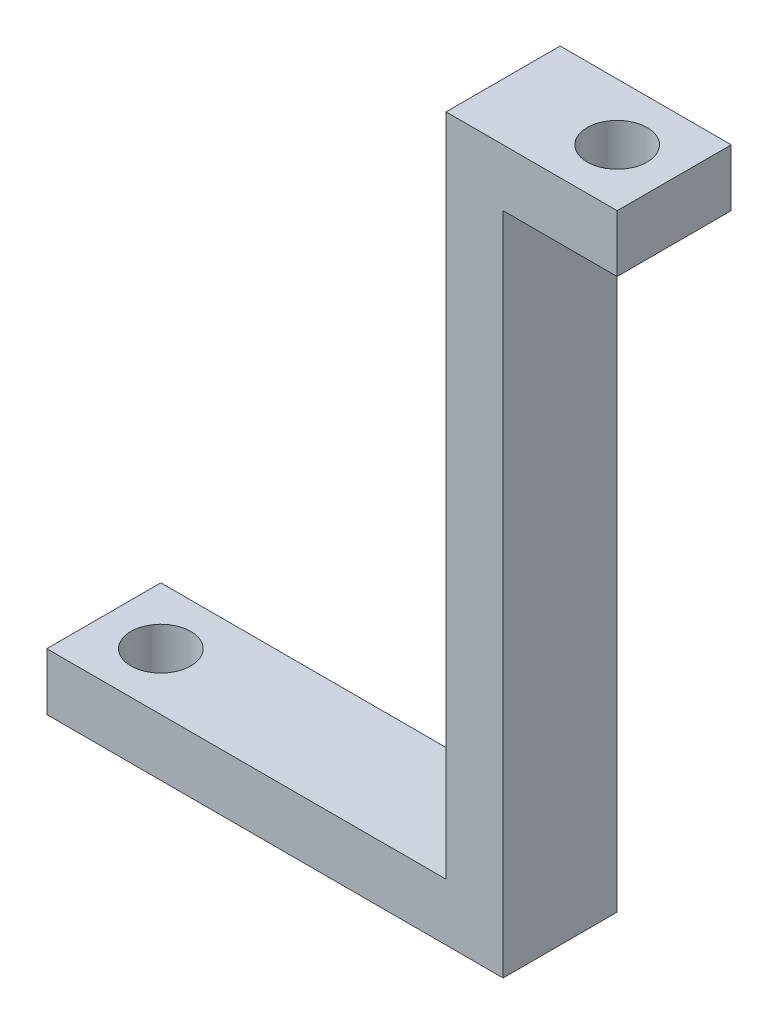
from build123d import *

# Parameters (mm, degrees)
SKETCH1_W           = 14
SKETCH1_H           = 4
SKETCH1_R           = 1.05
BOSS_EXTRUDE1_DEPTH = 2
SKETCH2_W           = 2
SKETCH2_H           = 4
BOSS_EXTRUDE2_DEPTH = 25.3
SKETCH3_W           = 4
SKETCH3_H           = 4
SKETCH3_R           = 1.05
BOSS_EXTRUDE3_DEPTH = 2


with BuildPart() as part:
    # Sketch1 → Boss-Extrude1 (new body)
    with BuildSketch(Plane(origin=(0, 0, 0), x_dir=(1, 0, 0), z_dir=(0, 1, 0))):
        with Locations((5, 0)):
            Rectangle(SKETCH1_W, SKETCH1_H)
        with Locations(Location((0, 0, 0), (0, 0, 270))):
            Circle(SKETCH1_R, mode=Mode.SUBTRACT)
    extrude(amount=BOSS_EXTRUDE1_DEPTH)

    # Sketch2 → Boss-Extrude2 (add)
    with BuildSketch(Plane(origin=(0, 0, 0), x_dir=(1, 0, 0), z_dir=(0, 1, 0))):
        with Locations((13, 0)):
            Rectangle(SKETCH2_W, SKETCH2_H)
    extrude(amount=BOSS_EXTRUDE2_DEPTH)

    # Sketch3 → Boss-Extrude3 (add)
    with BuildSketch(Plane(origin=(0, 25.3, 0), x_dir=(1, 0, 0), z_dir=(0, 1, 0))):
        with Locations((16, 0)):
            Rectangle(SKETCH3_W, SKETCH3_H)
        with Locations(Location((16, 0, 0), (0, 0, 270))):
            Circle(SKETCH3_R, mode=Mode.SUBTRACT)
    extrude(amount=-BOSS_EXTRUDE3_DEPTH)


solid = part.part
